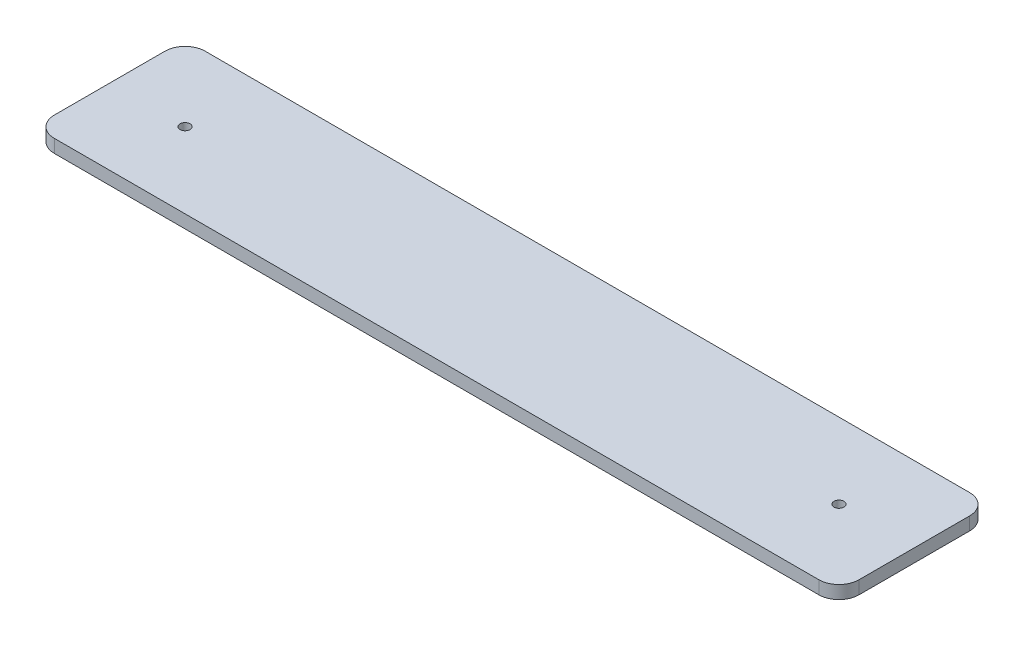
from build123d import *

# Parameters (mm, degrees)
SKETCH1_W           = 400
SKETCH1_H           = 75
BOSS_EXTRUDE1_DEPTH = 6.5
FILLET1_R           = 10
CUT_EXTRUDE1_REACH  = 409.022
SKETCH2_R           = 2.5


with BuildPart() as part:
    # Sketch1 → Boss-Extrude1 (new body)
    with BuildSketch(Plane(origin=(0, 0, 0), x_dir=(1, 0, 0), z_dir=(0, 1, 0))):
        with Locations((200, 37.5)):
            Rectangle(SKETCH1_W, SKETCH1_H)
    extrude(amount=BOSS_EXTRUDE1_DEPTH)

    # Fillet1
    fillet1_edges = [part.edges().sort_by_distance(p)[0] for p in [
        (0, 3.25, -75),
        (400, 3.25, -75),
        (400, 3.25, 0),
        (0, 3.25, 0),
    ]]
    fillet(fillet1_edges, radius=FILLET1_R)

    # Sketch2 → Cut-Extrude1 (cut, up to next)
    with BuildSketch(Plane(origin=(0, 6.5, 0), x_dir=(1, 0, 0), z_dir=(0, 1, 0)), mode=Mode.PRIVATE) as cut_extrude1_sk1:
        with Locations(Location((37.5, 37.5, 0), (0, 0, 270))):
            Circle(SKETCH2_R)
    cut_extrude1_tool1 = extrude(cut_extrude1_sk1.sketch, amount=-CUT_EXTRUDE1_REACH, mode=Mode.PRIVATE) & part.part
    # Sketch2 → Cut-Extrude1 (cut, up to next)
    with BuildSketch(Plane(origin=(0, 6.5, 0), x_dir=(1, 0, 0), z_dir=(0, 1, 0)), mode=Mode.PRIVATE) as cut_extrude1_sk2:
        with Locations(Location((362.5, 37.5, 0), (0, 0, 270))):
            Circle(SKETCH2_R)
    cut_extrude1_tool2 = extrude(cut_extrude1_sk2.sketch, amount=-CUT_EXTRUDE1_REACH, mode=Mode.PRIVATE) & part.part
    add(cut_extrude1_tool1.solids().sort_by_distance((37.5, 6.5, -37.5))[0], mode=Mode.SUBTRACT)
    add(cut_extrude1_tool2.solids().sort_by_distance((362.5, 6.5, -37.5))[0], mode=Mode.SUBTRACT)


solid = part.part
